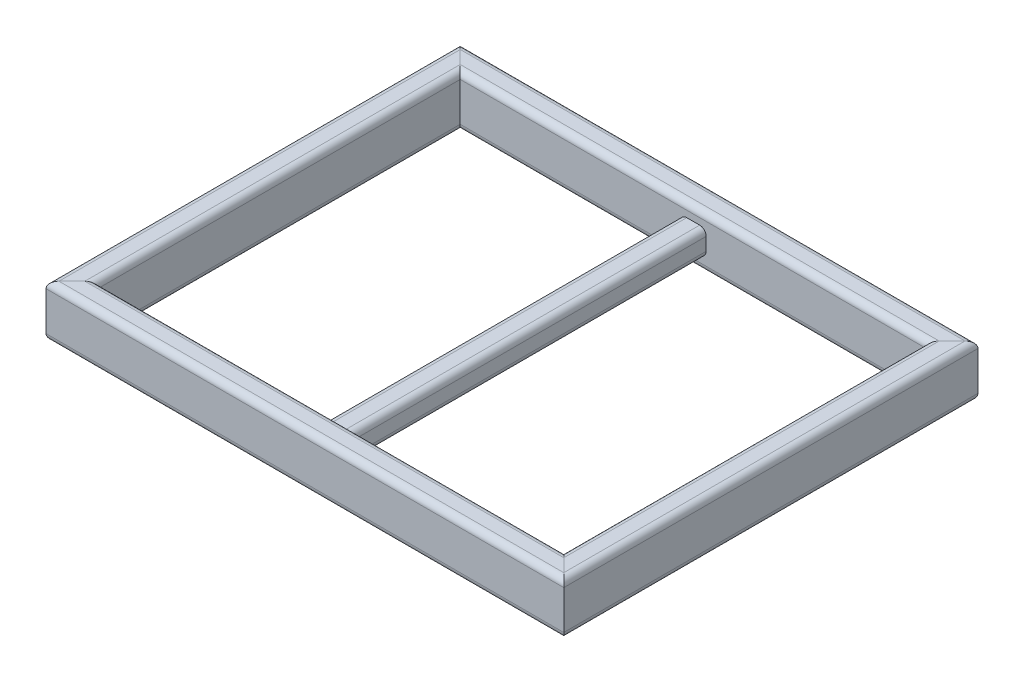
from build123d import *

# Parameters (mm, degrees)
RECTANGULAR_TUBE_4_X_2_X_0_25_1_DEPTH      = 895.996094832
RECTANGULAR_TUBE_4_X_2_X_0_25_1_DEPTH_BACK = 83.196094832
RECTANGULAR_TUBE_4_X_2_X_0_25_1_2_DEPTH    = 1182.392189664
RECTANGULAR_TUBE_4_X_2_X_0_25_1_3_DEPTH    = 979.192189664
RECTANGULAR_TUBE_4_X_2_X_0_25_1_4_DEPTH    = 1182.392189664
SQUARE_TUBE_2_X_2_X_0_25_1_DEPTH           = 812.8


with BuildPart() as part:
    # Sketch1 → Rectangular tube 4 X 2 X 0.25(1) (new, two sides: drawn at the far end of the back side and taken through both)
    with BuildSketch(Plane(origin=(-482.600021971, 0, 406.4), x_dir=(-1, 0, 0), z_dir=(0, 0, -1)).offset(-RECTANGULAR_TUBE_4_X_2_X_0_25_1_DEPTH_BACK)):
        with BuildLine():
            Line((-12.699978029, -50.8), (12.699978029, -50.8))
            ThreePointArc((12.699978029, -50.8), (21.68023415, -47.080256121), (25.399978029, -38.1))
            Line((25.399978029, -38.1), (25.399978029, 38.1))
            ThreePointArc((25.399978029, 38.1), (21.68023415, 47.080256121), (12.699978029, 50.8))
            Line((12.699978029, 50.8), (-12.699978029, 50.8))
            ThreePointArc((-12.699978029, 50.8), (-21.68023415, 47.080256121), (-25.399978029, 38.1))
            Line((-25.399978029, 38.1), (-25.399978029, -38.1))
            ThreePointArc((-25.399978029, -38.1), (-21.68023415, -47.080256121), (-12.699978029, -50.8))
        make_face()
        with BuildLine():
            Line((-12.699978029, -44.45), (12.699978029, -44.45))
            ThreePointArc((12.699978029, -44.45), (17.19010609, -42.590128061), (19.049978029, -38.1))
            Line((19.049978029, -38.1), (19.049978029, 38.1))
            ThreePointArc((19.049978029, 38.1), (17.19010609, 42.590128061), (12.699978029, 44.45))
            Line((12.699978029, 44.45), (-12.699978029, 44.45))
            ThreePointArc((-12.699978029, 44.45), (-17.19010609, 42.590128061), (-19.049978029, 38.1))
            Line((-19.049978029, 38.1), (-19.049978029, -38.1))
            ThreePointArc((-19.049978029, -38.1), (-17.19010609, -42.590128061), (-12.699978029, -44.45))
        make_face(mode=Mode.SUBTRACT)
    extrude(amount=RECTANGULAR_TUBE_4_X_2_X_0_25_1_DEPTH + RECTANGULAR_TUBE_4_X_2_X_0_25_1_DEPTH_BACK)

    # Rectangular tube 4 X 2 X 0.25(1) mitre 1
    split(bisect_by=Plane(origin=(-508, 0, 406.4), x_dir=(0, -1, 0), z_dir=(-0.707106781, 0, -0.707106781)), keep=Keep.TOP)

    # Rectangular tube 4 X 2 X 0.25(1) mitre 2
    split(bisect_by=Plane(origin=(-508, 0, -406.4), x_dir=(0, -1, 0), z_dir=(-0.707106781, 0, 0.707106781)), keep=Keep.TOP)


with BuildPart() as body_2:
    # Sketch1 on segment 2 (carried to segment 2) → Rectangular tube 4 X 2 X 0.25_1 2 (new body)
    with BuildSketch(Plane(origin=(-591.196094832, 0, -381.000021971), x_dir=(0, 0, -1), z_dir=(1, 0, 0))):
        with BuildLine():
            Line((-12.699978029, -50.8), (12.699978029, -50.8))
            ThreePointArc((12.699978029, -50.8), (21.68023415, -47.080256121), (25.399978029, -38.1))
            Line((25.399978029, -38.1), (25.399978029, 38.1))
            ThreePointArc((25.399978029, 38.1), (21.68023415, 47.080256121), (12.699978029, 50.8))
            Line((12.699978029, 50.8), (-12.699978029, 50.8))
            ThreePointArc((-12.699978029, 50.8), (-21.68023415, 47.080256121), (-25.399978029, 38.1))
            Line((-25.399978029, 38.1), (-25.399978029, -38.1))
            ThreePointArc((-25.399978029, -38.1), (-21.68023415, -47.080256121), (-12.699978029, -50.8))
        make_face()
        with BuildLine():
            Line((-12.699978029, -44.45), (12.699978029, -44.45))
            ThreePointArc((12.699978029, -44.45), (17.19010609, -42.590128061), (19.049978029, -38.1))
            Line((19.049978029, -38.1), (19.049978029, 38.1))
            ThreePointArc((19.049978029, 38.1), (17.19010609, 42.590128061), (12.699978029, 44.45))
            Line((12.699978029, 44.45), (-12.699978029, 44.45))
            ThreePointArc((-12.699978029, 44.45), (-17.19010609, 42.590128061), (-19.049978029, 38.1))
            Line((-19.049978029, 38.1), (-19.049978029, -38.1))
            ThreePointArc((-19.049978029, -38.1), (-17.19010609, -42.590128061), (-12.699978029, -44.45))
        make_face(mode=Mode.SUBTRACT)
    extrude(amount=RECTANGULAR_TUBE_4_X_2_X_0_25_1_2_DEPTH)

    # Rectangular tube 4 X 2 X 0.25_1 2 mitre
    split(bisect_by=Plane(origin=(-508, 0, -406.4), x_dir=(0, 1, 0), z_dir=(0.707106781, 0, -0.707106781)), keep=Keep.TOP)

    # Rectangular tube 4 X 2 X 0.25_1 2 mi 2
    split(bisect_by=Plane(origin=(508, 0, -406.4), x_dir=(0, -1, 0), z_dir=(-0.707106781, 0, -0.707106781)), keep=Keep.TOP)


with BuildPart() as body_3:
    # Sketch1 on segment 3 (carried to segment 3) → Rectangular tube 4 X 2 X 0.25_1 3 (new body)
    with BuildSketch(Plane(origin=(482.600021971, 0, -489.596094832), x_dir=(1, 0, 0), z_dir=(0, 0, 1))):
        with BuildLine():
            Line((-12.699978029, -50.8), (12.699978029, -50.8))
            ThreePointArc((12.699978029, -50.8), (21.68023415, -47.080256121), (25.399978029, -38.1))
            Line((25.399978029, -38.1), (25.399978029, 38.1))
            ThreePointArc((25.399978029, 38.1), (21.68023415, 47.080256121), (12.699978029, 50.8))
            Line((12.699978029, 50.8), (-12.699978029, 50.8))
            ThreePointArc((-12.699978029, 50.8), (-21.68023415, 47.080256121), (-25.399978029, 38.1))
            Line((-25.399978029, 38.1), (-25.399978029, -38.1))
            ThreePointArc((-25.399978029, -38.1), (-21.68023415, -47.080256121), (-12.699978029, -50.8))
        make_face()
        with BuildLine():
            Line((-12.699978029, -44.45), (12.699978029, -44.45))
            ThreePointArc((12.699978029, -44.45), (17.19010609, -42.590128061), (19.049978029, -38.1))
            Line((19.049978029, -38.1), (19.049978029, 38.1))
            ThreePointArc((19.049978029, 38.1), (17.19010609, 42.590128061), (12.699978029, 44.45))
            Line((12.699978029, 44.45), (-12.699978029, 44.45))
            ThreePointArc((-12.699978029, 44.45), (-17.19010609, 42.590128061), (-19.049978029, 38.1))
            Line((-19.049978029, 38.1), (-19.049978029, -38.1))
            ThreePointArc((-19.049978029, -38.1), (-17.19010609, -42.590128061), (-12.699978029, -44.45))
        make_face(mode=Mode.SUBTRACT)
    extrude(amount=RECTANGULAR_TUBE_4_X_2_X_0_25_1_3_DEPTH)

    # Rectangular tube 4 X 2 X 0.25_1 3 mitre
    split(bisect_by=Plane(origin=(508, 0, 406.4), x_dir=(0, 1, 0), z_dir=(0.707106781, 0, -0.707106781)), keep=Keep.TOP)

    # Rectangular tube 4 X 2 X 0.25_1 3 mi 2
    split(bisect_by=Plane(origin=(508, 0, -406.4), x_dir=(0, 1, 0), z_dir=(0.707106781, 0, 0.707106781)), keep=Keep.TOP)


with BuildPart() as body_4:
    # Sketch1 on segment 4 (carried to segment 4) → Rectangular tube 4 X 2 X 0.25_1 4 (new body)
    with BuildSketch(Plane(origin=(591.196094832, 0, 381.000021971), x_dir=(0, 0, 1), z_dir=(-1, 0, 0))):
        with BuildLine():
            Line((-12.699978029, -50.8), (12.699978029, -50.8))
            ThreePointArc((12.699978029, -50.8), (21.68023415, -47.080256121), (25.399978029, -38.1))
            Line((25.399978029, -38.1), (25.399978029, 38.1))
            ThreePointArc((25.399978029, 38.1), (21.68023415, 47.080256121), (12.699978029, 50.8))
            Line((12.699978029, 50.8), (-12.699978029, 50.8))
            ThreePointArc((-12.699978029, 50.8), (-21.68023415, 47.080256121), (-25.399978029, 38.1))
            Line((-25.399978029, 38.1), (-25.399978029, -38.1))
            ThreePointArc((-25.399978029, -38.1), (-21.68023415, -47.080256121), (-12.699978029, -50.8))
        make_face()
        with BuildLine():
            Line((-12.699978029, -44.45), (12.699978029, -44.45))
            ThreePointArc((12.699978029, -44.45), (17.19010609, -42.590128061), (19.049978029, -38.1))
            Line((19.049978029, -38.1), (19.049978029, 38.1))
            ThreePointArc((19.049978029, 38.1), (17.19010609, 42.590128061), (12.699978029, 44.45))
            Line((12.699978029, 44.45), (-12.699978029, 44.45))
            ThreePointArc((-12.699978029, 44.45), (-17.19010609, 42.590128061), (-19.049978029, 38.1))
            Line((-19.049978029, 38.1), (-19.049978029, -38.1))
            ThreePointArc((-19.049978029, -38.1), (-17.19010609, -42.590128061), (-12.699978029, -44.45))
        make_face(mode=Mode.SUBTRACT)
    extrude(amount=RECTANGULAR_TUBE_4_X_2_X_0_25_1_4_DEPTH)

    # Rectangular tube 4 X 2 X 0.25_1 4 mitre
    split(bisect_by=Plane(origin=(-508, 0, 406.4), x_dir=(0, 1, 0), z_dir=(0.707106781, 0, 0.707106781)), keep=Keep.TOP)

    # Rectangular tube 4 X 2 X 0.25_1 4 mi 2
    split(bisect_by=Plane(origin=(508, 0, 406.4), x_dir=(0, -1, 0), z_dir=(-0.707106781, 0, 0.707106781)), keep=Keep.TOP)


with BuildPart() as body_5:
    # Sketch11 → Square tube 2 X 2 X 0.25(1) (new body)
    with BuildSketch(Plane.XY.offset(-406.4)):
        with BuildLine():
            Line((-12.7, -25.4), (12.7, -25.4))
            ThreePointArc((12.7, -25.4), (21.680256121, -21.680256121), (25.4, -12.7))
            Line((25.4, -12.7), (25.4, 12.7))
            ThreePointArc((25.4, 12.7), (21.680256121, 21.680256121), (12.7, 25.4))
            Line((12.7, 25.4), (-12.7, 25.4))
            ThreePointArc((-12.7, 25.4), (-21.680256121, 21.680256121), (-25.4, 12.7))
            Line((-25.4, 12.7), (-25.4, -12.7))
            ThreePointArc((-25.4, -12.7), (-21.680256121, -21.680256121), (-12.7, -25.4))
        make_face()
        with BuildLine():
            Line((-12.7, -19.05), (12.7, -19.05))
            ThreePointArc((12.7, -19.05), (17.190128061, -17.190128061), (19.05, -12.7))
            Line((19.05, -12.7), (19.05, 12.7))
            ThreePointArc((19.05, 12.7), (17.190128061, 17.190128061), (12.7, 19.05))
            Line((12.7, 19.05), (-12.7, 19.05))
            ThreePointArc((-12.7, 19.05), (-17.190128061, 17.190128061), (-19.05, 12.7))
            Line((-19.05, 12.7), (-19.05, -12.7))
            ThreePointArc((-19.05, -12.7), (-17.190128061, -17.190128061), (-12.7, -19.05))
        make_face(mode=Mode.SUBTRACT)
    extrude(amount=SQUARE_TUBE_2_X_2_X_0_25_1_DEPTH)

    # Trim/Extend1
    split(bisect_by=Plane(origin=(0, 0, -355.600043942), x_dir=(0, -1, 0), z_dir=(0, 0, 1)), keep=Keep.TOP)

    # Trim_Extend1 3
    split(bisect_by=Plane.YX.offset(-355.600043942), keep=Keep.TOP)


solid = Compound([part.part, body_2.part, body_3.part, body_4.part, body_5.part])
